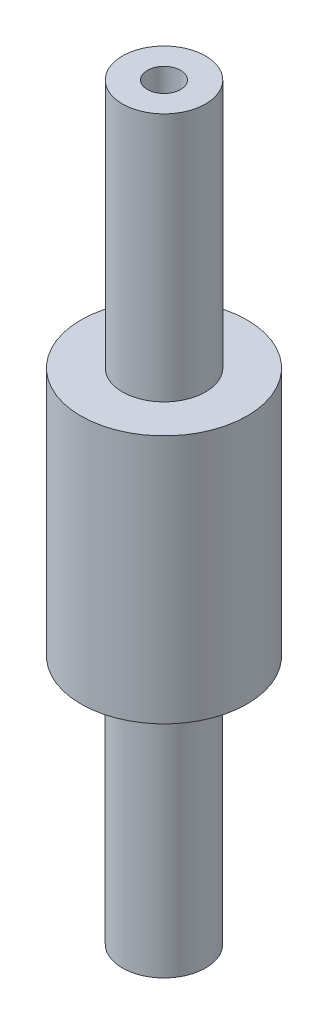
from build123d import *

# Parameters (mm, degrees)
SKETCH_1_R          = 10
EXTRUDE_1_DEPTH     = 30
SKETCH_2_R          = 5
EXTRUDE_2_DEPTH     = 30
EXTRUDE_START       = 30
SKETCH_3_R          = 5
EXTRUDE_3_DEPTH     = 30
SKETCH_4_R          = 2
CUT_EXTRUDE_1_DEPTH = 20
CUT_EXTRUDE_START   = -20
SKETCH_5_R          = 2
CUT_EXTRUDE_2_DEPTH = 20


with BuildPart() as part:
    # 草图1 → 凸台-拉伸1 (new body)
    with BuildSketch(Plane(origin=(0, 0, 0), x_dir=(1, 0, 0), z_dir=(0, 1, 0))):
        with Locations(Location((0, 0, 0), (0, 0, 270))):
            Circle(SKETCH_1_R)
    extrude(amount=EXTRUDE_1_DEPTH)

    # 草图2 → 凸台-拉伸2 (add)
    with BuildSketch(Plane(origin=(0, 30, 0), x_dir=(1, 0, 0), z_dir=(0, 1, 0))):
        with Locations(Location((0, 0, 0), (0, 0, 270))):
            Circle(SKETCH_2_R)
    extrude(amount=EXTRUDE_2_DEPTH)

    # 草图3 → 凸台-拉伸3 (add)
    with BuildSketch(Plane(origin=(0, 0, 0), x_dir=(-1, 0, 0), z_dir=(0, -1, 0)).offset(EXTRUDE_START)):
        with Locations(Location((0, 0, 0), (0, 0, 270))):
            Circle(SKETCH_3_R)
    extrude(amount=-EXTRUDE_3_DEPTH)

    # 草图4 → 切除-拉伸1 (cut)
    with BuildSketch(Plane(origin=(0, 60, 0), x_dir=(1, 0, 0), z_dir=(0, 1, 0))):
        with Locations(Location((0, 0, 0), (0, 0, 270))):
            Circle(SKETCH_4_R)
    extrude(amount=-CUT_EXTRUDE_1_DEPTH, mode=Mode.SUBTRACT)

    # 草图5 → 切除-拉伸2 (cut)
    with BuildSketch(Plane(origin=(0, -30, 0), x_dir=(-1, 0, 0), z_dir=(0, -1, 0)).offset(CUT_EXTRUDE_START)):
        with Locations(Location((0, 0, 0), (0, 0, 270))):
            Circle(SKETCH_5_R)
    extrude(amount=CUT_EXTRUDE_2_DEPTH, mode=Mode.SUBTRACT)


solid = part.part
